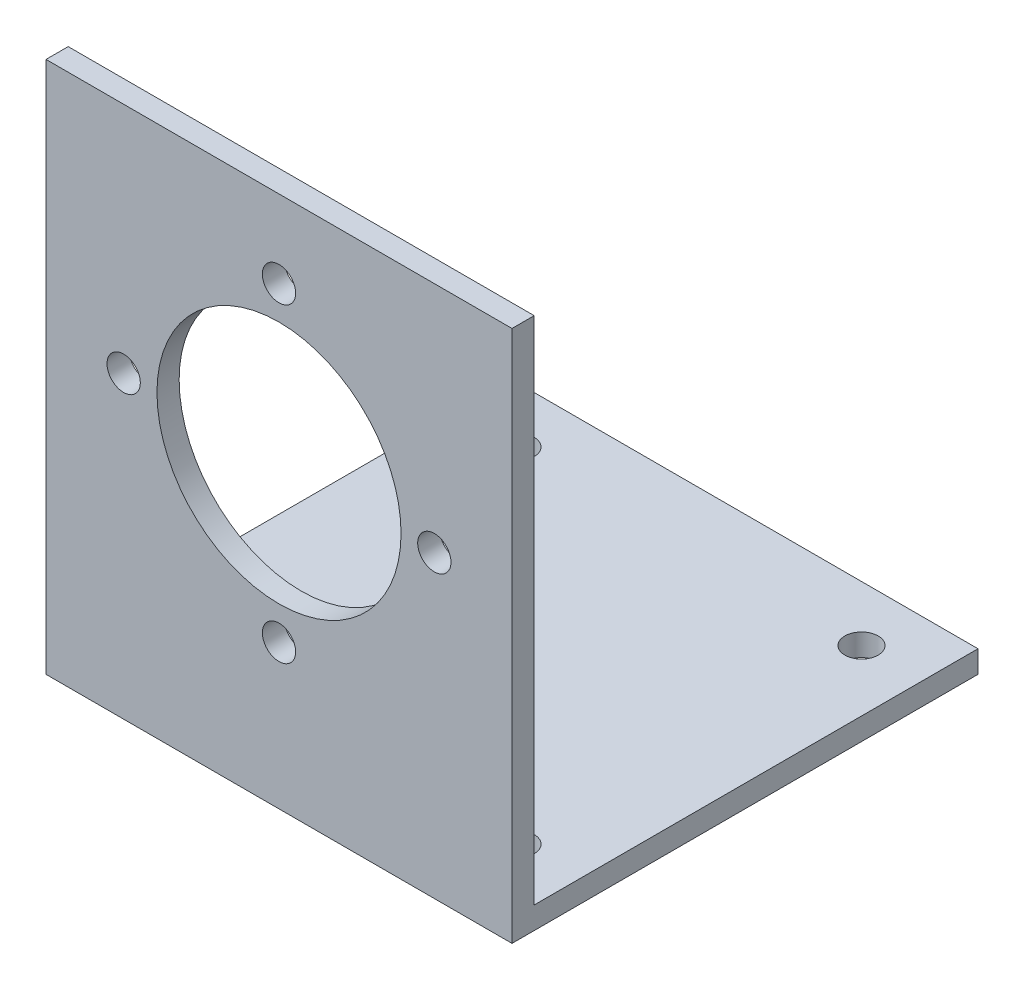
from build123d import *

# Parameters (mm, degrees)
EXTRUDE_1_DEPTH     = 42
SKETCH_2_R          = 11
CUT_EXTRUDE_1_DEPTH = 76.286120899
SKETCH_3_R          = 1.5
CUT_EXTRUDE_2_DEPTH = 77.367532368
SKETCH_4_R          = 1.5
CUT_EXTRUDE_3_DEPTH = 76.126559884


with BuildPart() as part:
    # 草图1 → 凸台-拉伸1 (new body)
    with BuildSketch(Plane(origin=(0, 0, 0), x_dir=(0, 0, -1), z_dir=(1, 0, 0))):
        Polygon((0, 2), (0, 0), (2, 0), (42, 0), (42, 2), (2, 2), (2, 48), (0, 48), align=None)
    extrude(amount=EXTRUDE_1_DEPTH)

    # 草图2 → 切除-拉伸1 (cut, through all)
    with BuildSketch(Plane(origin=(0, 0, -2), x_dir=(-1, 0, 0), z_dir=(0, 0, -1))):
        with Locations(Location((-21, 27, 0), (0, 0, 90))):
            Circle(SKETCH_2_R)
    extrude(amount=-CUT_EXTRUDE_1_DEPTH, mode=Mode.SUBTRACT)

    # 草图3 → 切除-拉伸2 (cut, through all)
    with BuildSketch(Plane.XY):
        with Locations((21, 41)):
            Circle(SKETCH_3_R)
        with Locations((21, 13)):
            Circle(SKETCH_3_R)
        with Locations((35, 27)):
            Circle(SKETCH_3_R)
        with Locations((7, 27)):
            Circle(SKETCH_3_R)
    extrude(amount=-CUT_EXTRUDE_2_DEPTH, mode=Mode.SUBTRACT)

    # 草图4 → 切除-拉伸3 (cut, through all)
    with BuildSketch(Plane(origin=(0, 2, 0), x_dir=(1, 0, 0), z_dir=(0, 1, 0))):
        with Locations(Location((5.5, 37, 0), (0, 0, 270))):
            Circle(SKETCH_4_R)
        with Locations(Location((36.5, 37, 0), (0, 0, 270))):
            Circle(SKETCH_4_R)
        with Locations(Location((36.5, 6, 0), (0, 0, 270))):
            Circle(SKETCH_4_R)
        with Locations(Location((5.5, 6, 0), (0, 0, 270))):
            Circle(SKETCH_4_R)
    extrude(amount=-CUT_EXTRUDE_3_DEPTH, mode=Mode.SUBTRACT)


solid = part.part
